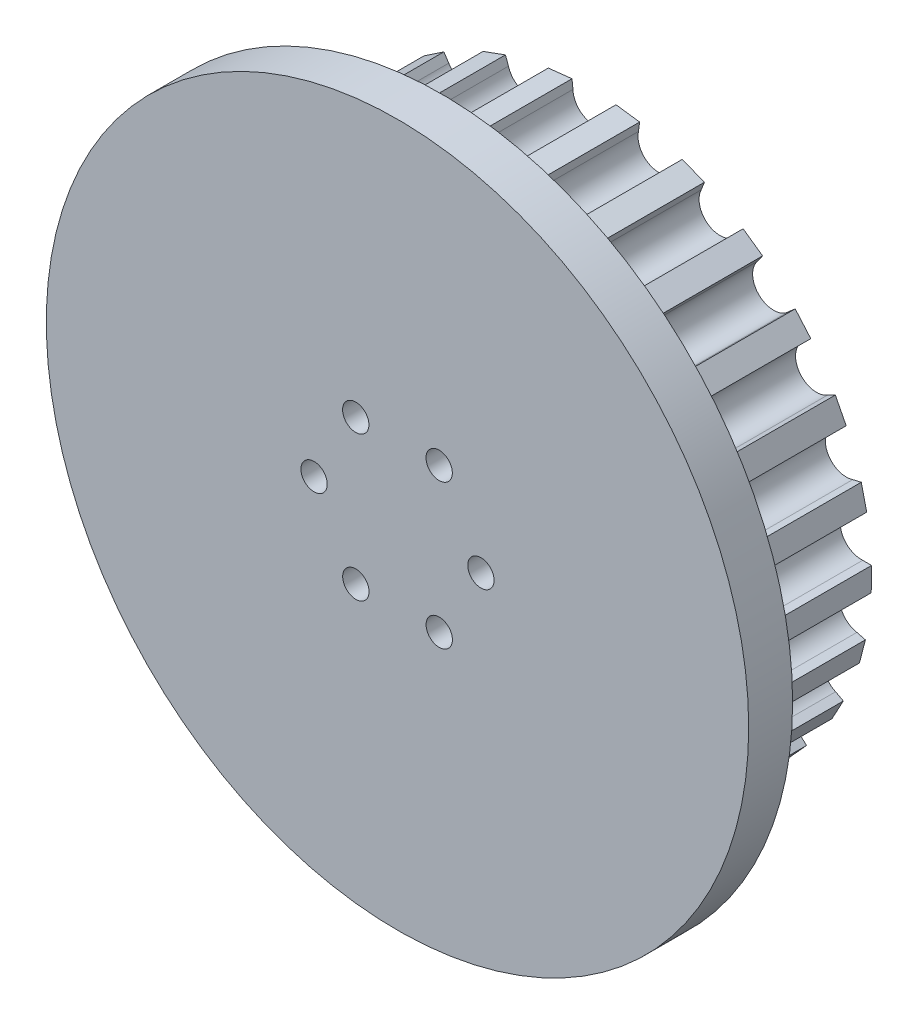
from build123d import *

# Parameters (mm, degrees)
BOSS_EXTRUDE4_DEPTH = 17
SKETCH6_R           = 40
BOSS_EXTRUDE5_DEPTH = 5
SKETCH9_R           = 22.5
CUT_EXTRUDE2_DEPTH  = 8.91448242
SKETCH10_R          = 1.5
CUT_EXTRUDE3_DEPTH  = 59.062300767


with BuildPart() as part:
    # Sketch2 → Boss-Extrude4 (new body)
    with BuildSketch(Plane.XY):
        with BuildLine():
            ThreePointArc((2.753920794, 30.877433835), (0.34063079, 28.610074808), (-2.017992552, 30.934248109))
            Line((-2.017992552, 30.934248109), (-2.126702362, 31.928321636))
            Line((-2.126702362, 31.928321636), (-4.824266539, 31.633321637))
            Line((-4.824266539, 31.633321637), (-4.715556729, 30.63924811))
            ThreePointArc((-4.715556729, 30.63924811), (-6.51610638, 27.860236315), (-9.362403491, 29.552417851))
            Line((-9.362403491, 29.552417851), (-9.705851758, 30.491589448))
            Line((-9.705851758, 30.491589448), (-12.254431503, 29.55959225))
            Line((-12.254431503, 29.55959225), (-11.910983235, 28.620420653))
            ThreePointArc((-11.910983235, 28.620420653), (-12.994151132, 25.491262155), (-16.162705571, 26.453108487))
            Line((-16.162705571, 26.453108487), (-16.72093233, 27.282796914))
            Line((-16.72093233, 27.282796914), (-18.97241345, 25.767966806))
            Line((-18.97241345, 25.767966806), (-18.414186691, 24.938278379))
            ThreePointArc((-18.414186691, 24.938278379), (-18.717023052, 21.640828495), (-22.023689951, 21.816440611))
            Line((-22.023689951, 21.816440611), (-22.764253092, 22.488427392))
            Line((-22.764253092, 22.488427392), (-24.587787689, 20.478800794))
            Line((-24.587787689, 20.478800794), (-23.847224548, 19.806814013))
            ThreePointArc((-23.847224548, 19.806814013), (-23.352129626, 16.532708544), (-26.604737525, 15.911880506))
            Line((-26.604737525, 15.911880506), (-27.48459821, 16.387112212))
            Line((-27.48459821, 16.387112212), (-28.774209082, 13.999481317))
            Line((-28.774209082, 13.999481317), (-27.894348397, 13.524249611))
            ThreePointArc((-27.894348397, 13.524249611), (-26.630095307, 10.463767667), (-29.639614458, 9.082579743))
            Line((-29.639614458, 9.082579743), (-30.607638382, 9.333437635))
            Line((-30.607638382, 9.333437635), (-31.288378032, 6.706562873))
            Line((-31.288378032, 6.706562873), (-30.320354108, 6.45570498))
            ThreePointArc((-30.320354108, 6.45570498), (-28.360416646, 3.786710647), (-30.951944734, 1.725432459))
            Line((-30.951944734, 1.725432459), (-31.951873866, 1.737337589))
            Line((-31.951873866, 1.737337589), (-31.984180179, -0.976116629))
            Line((-31.984180179, -0.976116629), (-30.984251048, -0.988021759))
            ThreePointArc((-30.984251048, -0.988021759), (-28.442533655, -3.110416231), (-30.465460488, -5.731990687))
            Line((-30.465460488, -5.731990687), (-31.43918258, -5.959730203))
            Line((-31.43918258, -5.959730203), (-30.821178033, -8.60206778))
            Line((-30.821178033, -8.60206778), (-29.847455941, -8.374328264))
            ThreePointArc((-29.847455941, -8.374328264), (-26.871673993, -9.826777024), (-28.208434416, -12.85629137))
            Line((-28.208434416, -12.85629137), (-29.09936028, -13.310440139))
            Line((-29.09936028, -13.310440139), (-27.866961049, -15.728098019))
            Line((-27.866961049, -15.728098019), (-26.976035185, -15.27394925))
            ThreePointArc((-26.976035185, -15.27394925), (-23.739130313, -15.972041255), (-24.312036669, -19.233431129))
            Line((-24.312036669, -19.233431129), (-25.068388933, -19.887595675))
            Line((-25.068388933, -19.887595675), (-23.293217582, -21.94006837))
            Line((-23.293217582, -21.94006837), (-22.536865318, -21.285903824))
            ThreePointArc((-22.536865318, -21.285903824), (-19.226954667, -21.189068505), (-19.002711722, -24.492793781))
            Line((-19.002711722, -24.492793781), (-19.58053394, -25.308956439))
            Line((-19.58053394, -25.308956439), (-17.365756976, -26.876961697))
            Line((-17.365756976, -26.876961697), (-16.787934758, -26.060799039))
            ThreePointArc((-16.787934758, -26.060799039), (-13.597378303, -25.174664112), (-12.589018241, -28.328724287))
            Line((-12.589018241, -28.328724287), (-12.954729488, -29.259452649))
            Line((-12.954729488, -29.259452649), (-10.429061697, -30.251863704))
            Line((-10.429061697, -30.251863704), (-10.063350451, -29.321135341))
            ThreePointArc((-10.063350451, -29.321135341), (-7.177571736, -27.697199747), (-5.44369678, -30.518292308))
            Line((-5.44369678, -30.518292308), (-5.576043245, -31.509495825))
            Line((-5.576043245, -31.509495825), (-2.88626726, -31.868637353))
            Line((-2.88626726, -31.868637353), (-2.753920794, -30.877433835))
            ThreePointArc((-2.753920794, -30.877433835), (-0.34063079, -28.610074808), (2.017992552, -30.934248109))
            Line((2.017992552, -30.934248109), (2.126702362, -31.928321636))
            Line((2.126702362, -31.928321636), (4.824266539, -31.633321637))
            Line((4.824266539, -31.633321637), (4.715556729, -30.63924811))
            ThreePointArc((4.715556729, -30.63924811), (6.51610638, -27.860236315), (9.362403491, -29.552417851))
            Line((9.362403491, -29.552417851), (9.705851758, -30.491589448))
            Line((9.705851758, -30.491589448), (12.254431503, -29.55959225))
            Line((12.254431503, -29.55959225), (11.910983235, -28.620420653))
            ThreePointArc((11.910983235, -28.620420653), (12.994151132, -25.491262155), (16.162705571, -26.453108487))
            Line((16.162705571, -26.453108487), (16.72093233, -27.282796914))
            Line((16.72093233, -27.282796914), (18.97241345, -25.767966806))
            Line((18.97241345, -25.767966806), (18.414186691, -24.938278379))
            ThreePointArc((18.414186691, -24.938278379), (18.717023052, -21.640828495), (22.023689951, -21.816440611))
            Line((22.023689951, -21.816440611), (22.764253092, -22.488427392))
            Line((22.764253092, -22.488427392), (24.587787689, -20.478800794))
            Line((24.587787689, -20.478800794), (23.847224548, -19.806814013))
            ThreePointArc((23.847224548, -19.806814013), (23.352129626, -16.532708544), (26.604737525, -15.911880506))
            Line((26.604737525, -15.911880506), (27.48459821, -16.387112212))
            Line((27.48459821, -16.387112212), (28.774209082, -13.999481317))
            Line((28.774209082, -13.999481317), (27.894348397, -13.524249611))
            ThreePointArc((27.894348397, -13.524249611), (26.630095307, -10.463767667), (29.639614458, -9.082579743))
            Line((29.639614458, -9.082579743), (30.607638382, -9.333437635))
            Line((30.607638382, -9.333437635), (31.288378032, -6.706562873))
            Line((31.288378032, -6.706562873), (30.320354108, -6.45570498))
            ThreePointArc((30.320354108, -6.45570498), (28.360416646, -3.786710647), (30.951944734, -1.725432459))
            Line((30.951944734, -1.725432459), (31.951873866, -1.737337589))
            Line((31.951873866, -1.737337589), (31.984180179, 0.976116629))
            Line((31.984180179, 0.976116629), (30.984251048, 0.988021759))
            ThreePointArc((30.984251048, 0.988021759), (28.442533655, 3.110416231), (30.465460488, 5.731990687))
            Line((30.465460488, 5.731990687), (31.43918258, 5.959730203))
            Line((31.43918258, 5.959730203), (30.821178033, 8.60206778))
            Line((30.821178033, 8.60206778), (29.847455941, 8.374328264))
            ThreePointArc((29.847455941, 8.374328264), (26.871673993, 9.826777024), (28.208434416, 12.85629137))
            Line((28.208434416, 12.85629137), (29.09936028, 13.310440139))
            Line((29.09936028, 13.310440139), (27.866961049, 15.728098019))
            Line((27.866961049, 15.728098019), (26.976035185, 15.27394925))
            ThreePointArc((26.976035185, 15.27394925), (23.739130313, 15.972041255), (24.312036669, 19.233431129))
            Line((24.312036669, 19.233431129), (25.068388933, 19.887595675))
            Line((25.068388933, 19.887595675), (23.293217582, 21.94006837))
            Line((23.293217582, 21.94006837), (22.536865318, 21.285903824))
            ThreePointArc((22.536865318, 21.285903824), (19.226954667, 21.189068505), (19.002711722, 24.492793781))
            Line((19.002711722, 24.492793781), (19.58053394, 25.308956439))
            Line((19.58053394, 25.308956439), (17.365756976, 26.876961697))
            Line((17.365756976, 26.876961697), (16.787934758, 26.060799039))
            ThreePointArc((16.787934758, 26.060799039), (13.597378303, 25.174664112), (12.589018241, 28.328724287))
            Line((12.589018241, 28.328724287), (12.954729488, 29.259452649))
            Line((12.954729488, 29.259452649), (10.429061697, 30.251863704))
            Line((10.429061697, 30.251863704), (10.063350451, 29.321135341))
            ThreePointArc((10.063350451, 29.321135341), (7.177571736, 27.697199747), (5.44369678, 30.518292308))
            Line((5.44369678, 30.518292308), (5.576043245, 31.509495825))
            Line((5.576043245, 31.509495825), (2.88626726, 31.868637353))
            Line((2.88626726, 31.868637353), (2.753920794, 30.877433835))
        make_face()
    extrude(amount=-BOSS_EXTRUDE4_DEPTH)

    # Sketch6 → Boss-Extrude5 (add)
    with BuildSketch(Plane.XY):
        Circle(SKETCH6_R)
    extrude(amount=BOSS_EXTRUDE5_DEPTH)

    # Sketch9 → Cut-Extrude2 (cut)
    with BuildSketch(Plane(origin=(0, 0, -17), x_dir=(-1, 0, 0), z_dir=(0, 0, -1))):
        Circle(SKETCH9_R)
    extrude(amount=-CUT_EXTRUDE2_DEPTH, mode=Mode.SUBTRACT)

    # Sketch10 → Cut-Extrude3 (cut, through all)
    with BuildSketch(Plane(origin=(0, 0, -8.08551758), x_dir=(-1, 0, 0), z_dir=(0, 0, -1))):
        with Locations((-4.744582961, 8.230366488)):
            Circle(SKETCH10_R)
        with Locations((-9.499997942, 0.006253869)):
            Circle(SKETCH10_R)
        with Locations((-4.75541498, -8.224112619)):
            Circle(SKETCH10_R)
        with Locations((4.744582961, -8.230366488)):
            Circle(SKETCH10_R)
        with Locations((9.499997942, -0.006253869)):
            Circle(SKETCH10_R)
        with Locations((4.75541498, 8.224112619)):
            Circle(SKETCH10_R)
    extrude(amount=-CUT_EXTRUDE3_DEPTH, mode=Mode.SUBTRACT)


solid = part.part
